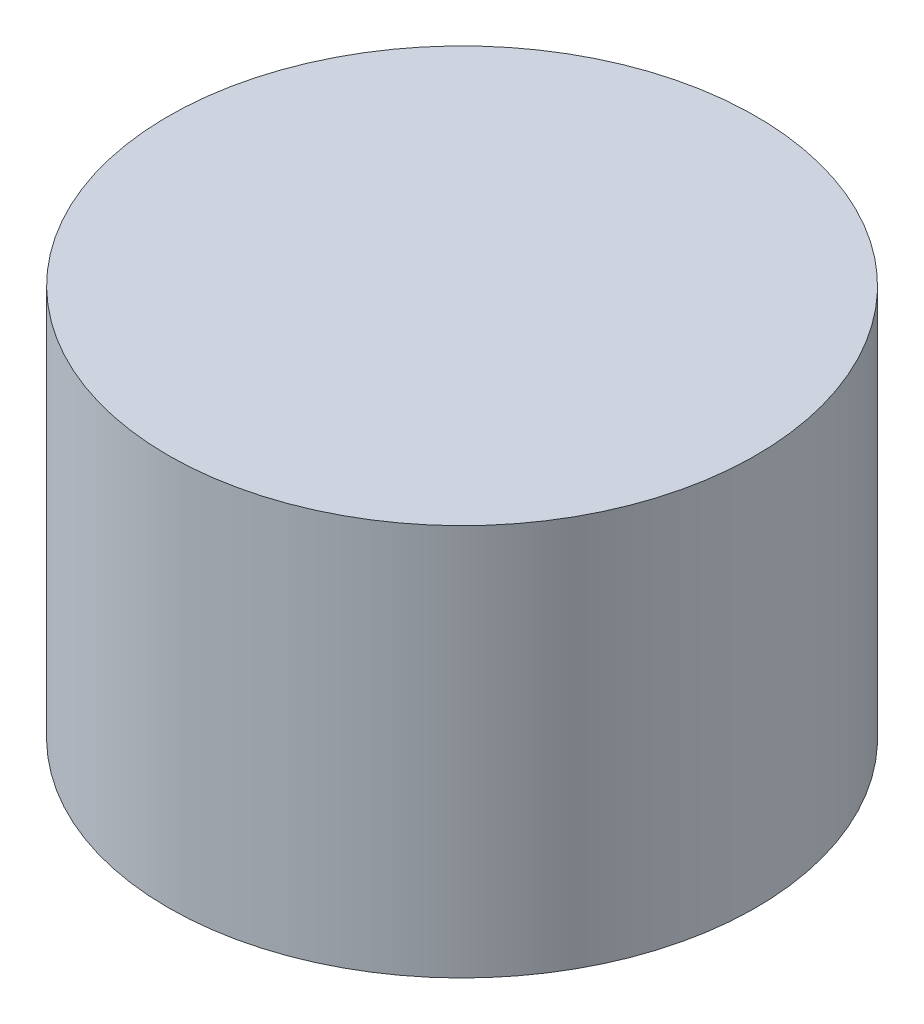
from build123d import *

# Parameters (mm, degrees)
SKETCH1_R           = 38.1
BOSS_EXTRUDE1_DEPTH = 50.8


with BuildPart() as part:
    # Sketch1 → Boss-Extrude1 (new body)
    with BuildSketch(Plane(origin=(0, 0, 0), x_dir=(1, 0, 0), z_dir=(0, 1, 0))):
        with Locations(Location((0, 0, 0), (0, 0, 270))):
            Circle(SKETCH1_R)
    extrude(amount=BOSS_EXTRUDE1_DEPTH)


solid = part.part
